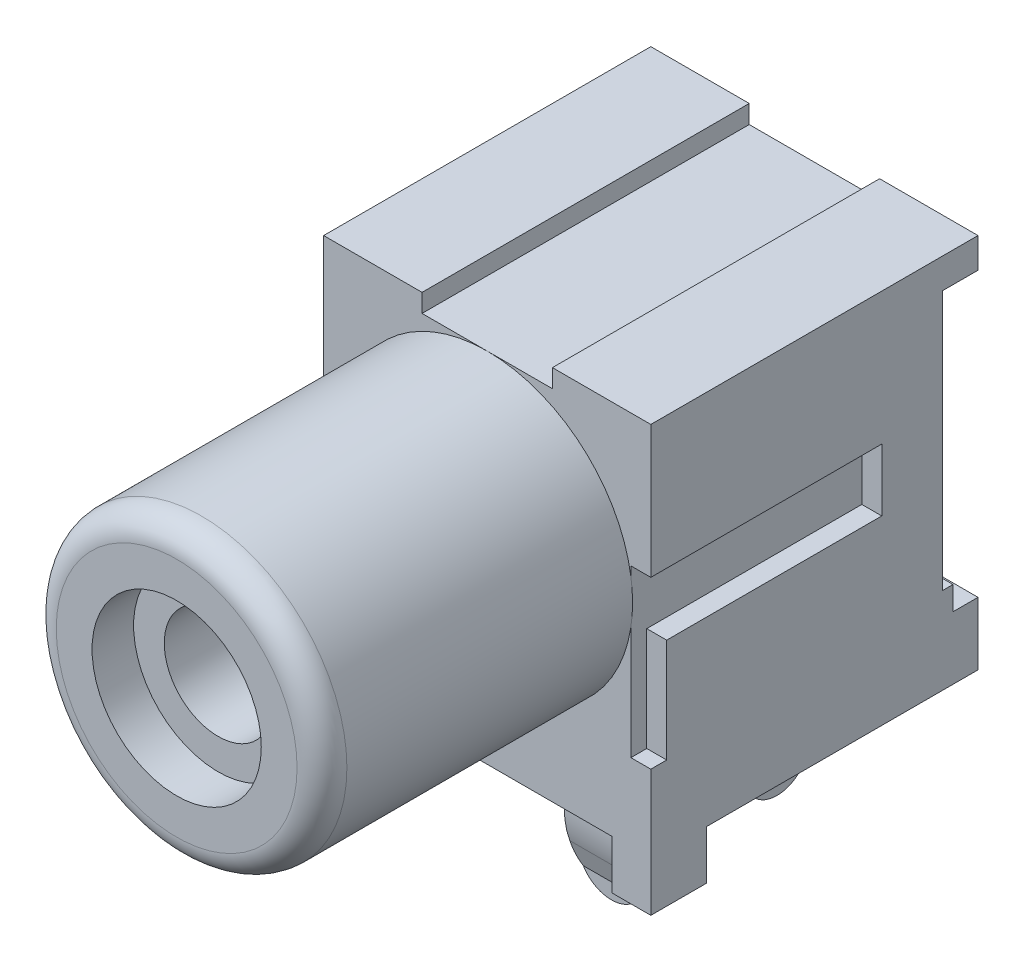
from build123d import *

# Parameters (mm, degrees)
SKETCH1_W          = 10.0076
SKETCH1_H          = 13.0048
EXTRUDE1_DEPTH     = 10.0076
SKETCH2_R          = 4.445
EXTRUDE2_DEPTH     = 9.4996
FILLET1_R          = 0.762
SKETCH3_R          = 1.64973
CUT_EXTRUDE1_DEPTH = 9.4996
CUT_EXTRUDE2_DEPTH = 0.6096
SKETCH5_W          = 1.082217623
SKETCH5_H          = 7.941923042
CUT_EXTRUDE3_DEPTH = 20.220534294
SKETCH6_W          = 7.62
SKETCH6_H          = 1.4986
CUT_EXTRUDE4_DEPTH = 18.155608274
SKETCH7_R          = 2.588003294
CUT_EXTRUDE5_DEPTH = 1.27
SKETCH8_W          = 3.9878
SKETCH8_H          = 0.5588
CUT_EXTRUDE6_DEPTH = 18.155608274
SKETCH10_W         = 8.302680101
SKETCH10_H         = 1.4986
CUT_EXTRUDE8_DEPTH = 20.220534294
SKETCH11_W         = 0.763867388
SKETCH11_H         = 0.721519404
CUT_EXTRUDE9_DEPTH = 20.220534294
SKETCH12_W         = 2.0066
SKETCH12_H         = 0.381
FILLET2_R          = 0.9906
EXTRUDE3_DEPTH     = 0.254


with BuildPart() as part:
    # Sketch1 → Extrude1 (new body)
    with BuildSketch(Plane.XY):
        with Locations((0, 6.5024)):
            Rectangle(SKETCH1_W, SKETCH1_H)
    extrude(amount=-EXTRUDE1_DEPTH)

    # Sketch2 → Extrude2 (add)
    with BuildSketch(Plane.XY):
        with Locations(Location((0, 8.001, 0), (0, 0, 180))):
            Circle(SKETCH2_R)
    extrude(amount=EXTRUDE2_DEPTH)

    # Fillet1
    fillet1_edges = [part.edges().sort_by_distance(p)[0] for p in [
        (4.445, 8.001, 9.4996),
    ]]
    fillet(fillet1_edges, radius=FILLET1_R)

    # Sketch3 → Cut-Extrude1 (cut)
    with BuildSketch(Plane.XY.offset(9.4996)):
        with Locations((0, 8.001)):
            Circle(SKETCH3_R)
    extrude(amount=-CUT_EXTRUDE1_DEPTH, mode=Mode.SUBTRACT)

    # Sketch4 → Cut-Extrude2 (cut)
    with BuildSketch(Plane(origin=(5.0038, 0, 0), x_dir=(0, 0, -1), z_dir=(1, 0, 0))):
        Polygon((0, 8.9535), (7.063951239, 8.9535), (7.063951239, 7.0485), (0.484947525, 7.0485), (0.484947525, 3.872808147), (0, 3.872808147), align=None)
    cut_extrude2 = extrude(amount=-CUT_EXTRUDE2_DEPTH, mode=Mode.SUBTRACT)

    # Sketch5 → Cut-Extrude3 (cut, through all)
    with BuildSketch(Plane(origin=(5.0038, 0, 0), x_dir=(0, 0, -1), z_dir=(1, 0, 0))):
        with Locations((9.466491189, 8.113930335)):
            Rectangle(SKETCH5_W, SKETCH5_H)
    extrude(amount=-CUT_EXTRUDE3_DEPTH, mode=Mode.SUBTRACT)

    # Sketch6 → Cut-Extrude4 (cut, through all)
    with BuildSketch(Plane.XY):
        with Locations((0, 0.7493)):
            Rectangle(SKETCH6_W, SKETCH6_H)
    extrude(amount=-CUT_EXTRUDE4_DEPTH, mode=Mode.SUBTRACT)

    # Sketch7 → Cut-Extrude5 (cut)
    with BuildSketch(Plane.XY.offset(9.4996)):
        with Locations((0, 8.001)):
            Circle(SKETCH7_R)
    extrude(amount=-CUT_EXTRUDE5_DEPTH, mode=Mode.SUBTRACT)

    # Sketch8 → Cut-Extrude6 (cut, through all)
    with BuildSketch(Plane.XY):
        with Locations((0, 12.7254)):
            Rectangle(SKETCH8_W, SKETCH8_H)
    extrude(amount=-CUT_EXTRUDE6_DEPTH, mode=Mode.SUBTRACT)

    # Mirror1: Cut-Extrude2 across plane
    add(cut_extrude2.mirror(Plane(origin=(0, 0, 0), x_dir=(0, 0, 1), z_dir=(1, 0, 0))), mode=Mode.SUBTRACT)

    # Sketch10 → Cut-Extrude8 (cut, through all)
    with BuildSketch(Plane(origin=(5.0038, 0, 0), x_dir=(0, 0, -1), z_dir=(1, 0, 0))):
        with Locations((5.85625995, 0.7493)):
            Rectangle(SKETCH10_W, SKETCH10_H)
    extrude(amount=-CUT_EXTRUDE8_DEPTH, mode=Mode.SUBTRACT)

    # Sketch11 → Cut-Extrude9 (cut, through all)
    with BuildSketch(Plane(origin=(5.0038, 0, 0), x_dir=(0, 0, -1), z_dir=(1, 0, 0))):
        with Locations((9.625666306, 3.782209112)):
            Rectangle(SKETCH11_W, SKETCH11_H)
    extrude(amount=-CUT_EXTRUDE9_DEPTH, mode=Mode.SUBTRACT)

    # Sweep1: sweep along a path in Sketch13
    with BuildLine(Plane(origin=(0, 0, 0), x_dir=(0, 0, -1), z_dir=(1, 0, 0))) as sweep1_path:
        Line((3.9878, 1.4986), (3.9878, 0.118233573))
        ThreePointArc((3.9878, 0.118233573), (3.963359224, -0.233279995), (3.890507253, -0.578028788))
        ThreePointArc((3.890507253, -0.578028788), (3.561195264, -1.630409905), (3.70889827, -2.723175307))
        Line((3.70889827, -2.723175307), (3.9878, -3.4798))
        Line((3.9878, -3.4798), (3.9878, -3.9878))
    # Sketch12 → Sweep1 (sweep)
    with BuildSketch(Plane.XZ.offset(-1.4986)):
        with Locations((0, -3.9878)):
            Rectangle(SKETCH12_W, SKETCH12_H)
    sweep(path=sweep1_path.line, transition=Transition.RIGHT)

    # Fillet2
    fillet2_edges = [part.edges().sort_by_distance(p)[0] for p in [
        (1.0033, -3.9878, -3.9878),
        (-1.0033, -3.9878, -3.9878),
    ]]
    fillet(fillet2_edges, radius=FILLET2_R)

    # Sketch14 → Extrude3 (add, symmetric)
    with BuildSketch(Plane(origin=(0, 0, 0), x_dir=(0, 0, -1), z_dir=(1, 0, 0))):
        with BuildLine():
            Line((10.007599936, 0), (9.055129464, 0))
            Line((9.055129464, 0), (9.055129464, -1.459458075))
            Line((9.055129464, -1.459458075), (10.007599936, -1.950513398))
            Line((10.007599936, -1.950513398), (9.466255271, -3.000527083))
            ThreePointArc((9.466255271, -3.000527083), (8.363488428, -3.473928976), (7.628868664, -2.52496224))
            Line((7.628868664, -2.52496224), (7.628868664, 1.4986))
            Line((7.628868664, 1.4986), (10.007599936, 1.4986))
            Line((10.007599936, 1.4986), (10.007599936, 0))
        make_face()
    extrude(amount=EXTRUDE3_DEPTH, both=True)


solid = part.part
